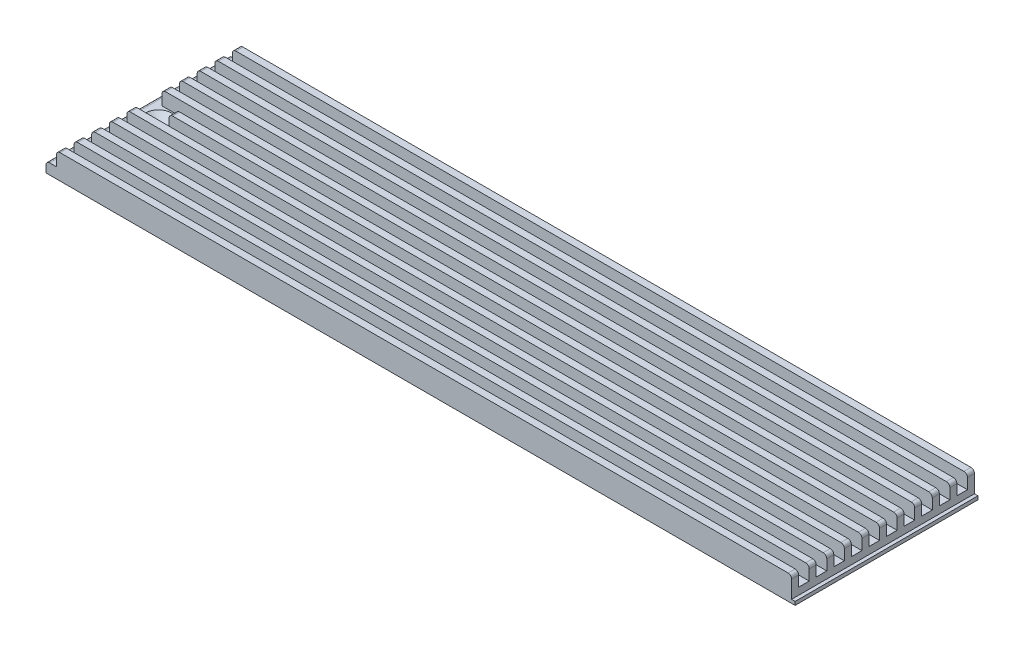
from build123d import *

# Parameters (mm, degrees)
SKETCH1_W                                            = 106.5
SKETCH1_H                                            = 26
BOSS_EXTRUDE1_DEPTH                                  = 3.5
SKETCH2_W                                            = 0.5
SKETCH2_H                                            = 3
SKETCH2_W_2                                          = 1.5
SKETCH2_H_2                                          = 2
CUT_EXTRUDE1_DEPTH                                   = 110.683635972
FILLET1_R                                            = 0.5
SKETCH3_W                                            = 107.180882747
SKETCH3_H                                            = 1.5
SKETCH3_W_2                                          = 106.799236883
SKETCH3_W_3                                          = 106.532134073
SKETCH3_W_4                                          = 106.710473135
CUT_EXTRUDE2_DEPTH                                   = 2
SKETCH4_W                                            = 3.5
SKETCH4_H                                            = 1
CUT_EXTRUDE3_DEPTH                                   = 2
CSK_FOR_M1_6_COUNTERSUNK_FLAT_HEAD_SCREW_D           = 1.8
CSK_FOR_M1_6_COUNTERSUNK_FLAT_HEAD_SCREW_DEPTH       = 15
CSK_FOR_M1_6_COUNTERSUNK_FLAT_HEAD_SCREW_CSINK_D     = 3.6
CSK_FOR_M1_6_COUNTERSUNK_FLAT_HEAD_SCREW_CSINK_ANGLE = 90
CSK_FOR_M1_6_COUNTERSUNK_FLAT_HEAD_SCREW_TIP         = 0.540774557
SKETCH11_R                                           = 0.5
CUT_EXTRUDE4_DEPTH                                   = 110.683635972
FILLET2_R                                            = 0.5


with BuildPart() as part:
    # Sketch1 → Boss-Extrude1 (new body)
    with BuildSketch(Plane(origin=(0, 0, 0), x_dir=(1, 0, 0), z_dir=(0, 1, 0))):
        with Locations((53.25, -13)):
            Rectangle(SKETCH1_W, SKETCH1_H)
    extrude(amount=BOSS_EXTRUDE1_DEPTH)

    # Sketch2 → Cut-Extrude1 (cut, through all)
    with BuildSketch(Plane.XY.offset(26)):
        with Locations((106.25, 2)):
            Rectangle(SKETCH2_W, SKETCH2_H)
        with Locations((0.75, 2.5)):
            Rectangle(SKETCH2_W_2, SKETCH2_H_2)
    extrude(amount=-CUT_EXTRUDE1_DEPTH, mode=Mode.SUBTRACT)

    # Fillet1
    fillet1_edges = [part.edges().sort_by_distance(p)[0] for p in [
        (106, 3.5, 13),
        (0, 1.5, 13),
        (1.5, 3.5, 13),
    ]]
    fillet(fillet1_edges, radius=FILLET1_R)

    # Sketch3 → Cut-Extrude2 (cut)
    with BuildSketch(Plane(origin=(0, 3.5, 0), x_dir=(1, 0, 0), z_dir=(0, 1, 0))):
        with Locations((54.409558627, -1.75)):
            Rectangle(SKETCH3_W, SKETCH3_H)
        with Locations((54.310652166, -4.25)):
            Rectangle(SKETCH3_W_2, SKETCH3_H)
        with Locations((54.482997461, -6.75)):
            Rectangle(SKETCH3_W_3, SKETCH3_H)
        with Locations((54.482997461, -9.25)):
            Rectangle(SKETCH3_W_3, SKETCH3_H)
        Polygon((0.819117253, -23.5), (108, -23.5), (106.5, -25), (0.819117253, -25), align=None)
        with Locations((54.310652166, -21.75)):
            Rectangle(SKETCH3_W_2, SKETCH3_H)
        with Locations((54.482997461, -19.25)):
            Rectangle(SKETCH3_W_3, SKETCH3_H)
        with Locations((54.482997461, -16.75)):
            Rectangle(SKETCH3_W_3, SKETCH3_H)
        with Locations((54.496061473, -11.75)):
            Rectangle(SKETCH3_W_4, SKETCH3_H)
        with Locations((54.496061473, -14.25)):
            Rectangle(SKETCH3_W_4, SKETCH3_H)
    extrude(amount=-CUT_EXTRUDE2_DEPTH, mode=Mode.SUBTRACT)

    # Sketch4 → Cut-Extrude3 (cut)
    with BuildSketch(Plane(origin=(0, 1.5, 0), x_dir=(1, 0, 0), z_dir=(0, 1, 0))):
        with Locations((3.25, -13)):
            Rectangle(SKETCH4_W, SKETCH4_H)
        Polygon((1.5, -12.5), (1.5, -11.238548645), (5, -11.238548645), (5, -12.5), (106, -12.5), (106, -11), (1.5, -11), (1.5, -10), (106, -10), (106, -8.5), (1.5, -8.5), (1.5, -7.5), (106, -7.5), (106, -6), (1.5, -6), (1.5, -5), (106, -5), (106, -3.5), (1.5, -3.5), (1.5, -2.5), (106, -2.5), (106, -1), (1.5, -1), (1.5, 0), (0.5, 0), (0.5, -26), (1.5, -26), (1.5, -25), (106, -25), (106, -23.5), (1.5, -23.5), (1.5, -22.5), (106, -22.5), (106, -21), (1.5, -21), (1.5, -20), (106, -20), (106, -18.5), (1.5, -18.5), (1.5, -17.5), (106, -17.5), (106, -16), (1.5, -16), (1.5, -15), (106, -15), (106, -13.5), (5, -13.5), (5, -14.524020237), (1.5, -14.524020237), (1.5, -13.5), align=None)
    extrude(amount=CUT_EXTRUDE3_DEPTH, mode=Mode.SUBTRACT)

    # CSK for M1.6 Countersunk Flat Head Screw2
    with Locations(Plane(origin=(3, 1.5, 13), x_dir=(1, 0, 0), z_dir=(0, 1, 0))):
        with Locations((0, 0)):
            CounterSinkHole(CSK_FOR_M1_6_COUNTERSUNK_FLAT_HEAD_SCREW_D / 2, CSK_FOR_M1_6_COUNTERSUNK_FLAT_HEAD_SCREW_CSINK_D / 2, depth=CSK_FOR_M1_6_COUNTERSUNK_FLAT_HEAD_SCREW_DEPTH, counter_sink_angle=CSK_FOR_M1_6_COUNTERSUNK_FLAT_HEAD_SCREW_CSINK_ANGLE)
            with Locations((0, 0, -(CSK_FOR_M1_6_COUNTERSUNK_FLAT_HEAD_SCREW_DEPTH + CSK_FOR_M1_6_COUNTERSUNK_FLAT_HEAD_SCREW_TIP / 2))):  # 118° drill point
                Cone(0, CSK_FOR_M1_6_COUNTERSUNK_FLAT_HEAD_SCREW_D / 2, CSK_FOR_M1_6_COUNTERSUNK_FLAT_HEAD_SCREW_TIP, mode=Mode.SUBTRACT)

    # Sketch11 → Cut-Extrude4 (cut, through all)
    with BuildSketch(Plane.XZ):
        with Locations(Location((7, 4.25, 0), (0, 0, 270))):
            Circle(SKETCH11_R)
    extrude(amount=-CUT_EXTRUDE4_DEPTH, mode=Mode.SUBTRACT)

    # Fillet2
    fillet2_edges = [part.edges().sort_by_distance(p)[0] for p in [
        (5, 3.5, 13),
    ]]
    fillet(fillet2_edges, radius=FILLET2_R)


solid = part.part
